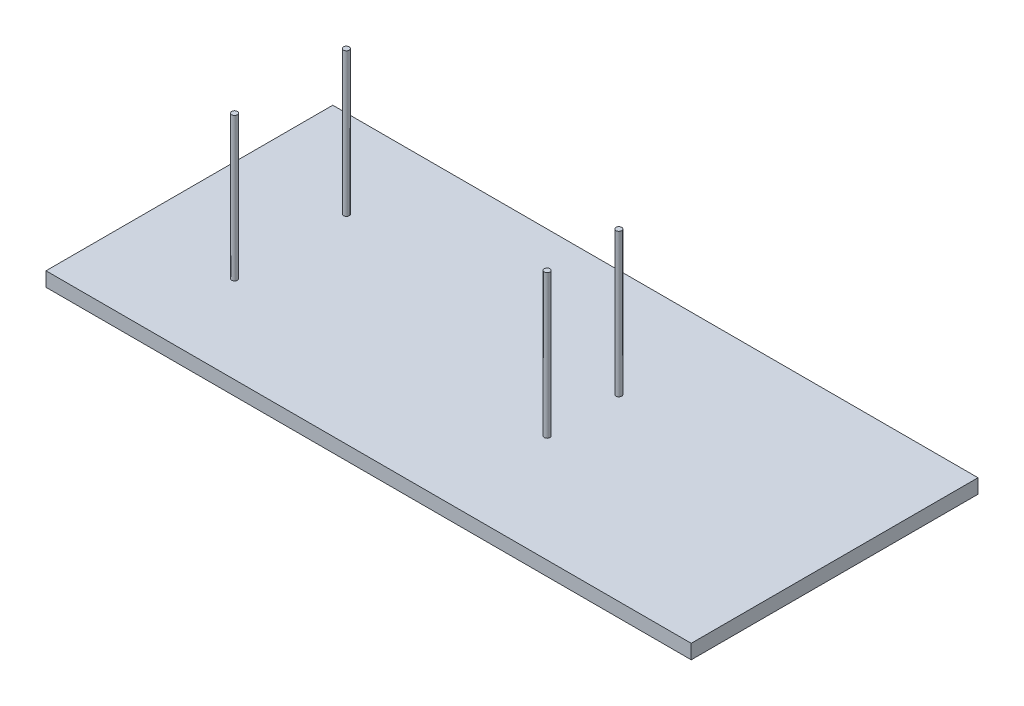
from build123d import *

# Parameters (mm, degrees)
SKETCH_1_W          = 600
SKETCH_1_H          = 200
EXTRUDE_1_DEPTH     = 10
SKETCH_2_R          = 2
EXTRUDE_2_DEPTH     = 100
SKETCH_3_W          = 100
SKETCH_3_H          = 200
SKETCH_3_W_2        = 50
CUT_EXTRUDE_1_DEPTH = 10


with BuildPart() as part:
    # 草图1 → 凸台-拉伸1 (new body)
    with BuildSketch(Plane(origin=(0, 0, 0), x_dir=(1, 0, 0), z_dir=(0, 1, 0))):
        Rectangle(SKETCH_1_W, SKETCH_1_H)
    extrude(amount=-EXTRUDE_1_DEPTH)

    # 草图2 → 凸台-拉伸2 (add)
    with BuildSketch(Plane(origin=(0, 0, 0), x_dir=(1, 0, 0), z_dir=(0, 1, 0))):
        with Locations(Location((-129.5, 39, 0), (0, 0, 90))):
            Circle(SKETCH_2_R)
        with Locations(Location((-129.5, -39, 0), (0, 0, 90))):
            Circle(SKETCH_2_R)
        with Locations(Location((74.5, 25, 0), (0, 0, 90))):
            Circle(SKETCH_2_R)
        with Locations(Location((74.5, -25, 0), (0, 0, 90))):
            Circle(SKETCH_2_R)
    extrude(amount=EXTRUDE_2_DEPTH)

    # 草图3 → 切除-拉伸1 (cut)
    with BuildSketch(Plane(origin=(0, 0, 0), x_dir=(1, 0, 0), z_dir=(0, 1, 0))):
        with Locations((-250, 0)):
            Rectangle(SKETCH_3_W, SKETCH_3_H)
        with Locations((275, 0)):
            Rectangle(SKETCH_3_W_2, SKETCH_3_H)
    extrude(amount=-CUT_EXTRUDE_1_DEPTH, mode=Mode.SUBTRACT)


solid = part.part
